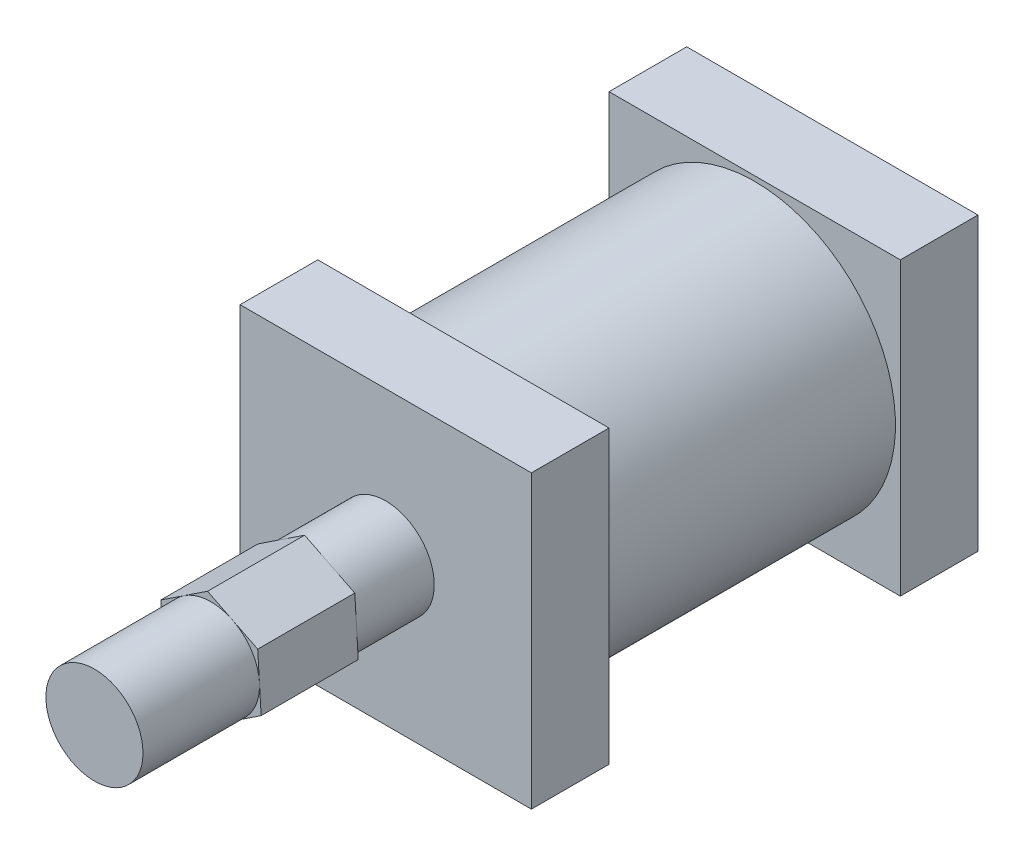
from build123d import *

# Parameters (mm, degrees)
SKETCH1_W           = 38.1
SKETCH1_H           = 38.1
BOSS_EXTRUDE1_DEPTH = 10.16
SKETCH2_R           = 18.415
BOSS_EXTRUDE2_DEPTH = 38.1
SKETCH3_W           = 38.1
SKETCH3_H           = 38.1
BOSS_EXTRUDE3_DEPTH = 10.16
SKETCH4_R           = 6.35
BOSS_EXTRUDE4_DEPTH = 10.16
BOSS_EXTRUDE5_DEPTH = 12.7
SKETCH6_R           = 6.35
BOSS_EXTRUDE6_DEPTH = 15.24


with BuildPart() as part:
    # Sketch1 → Boss-Extrude1 (new body)
    with BuildSketch(Plane.XY):
        with Locations((19.05, 19.05)):
            Rectangle(SKETCH1_W, SKETCH1_H)
    extrude(amount=BOSS_EXTRUDE1_DEPTH)

    # Sketch2 → Boss-Extrude2 (add)
    with BuildSketch(Plane.XY.offset(10.16)):
        with Locations(Location((19.05, 19.05, 0), (0, 0, 180))):
            Circle(SKETCH2_R)
    extrude(amount=BOSS_EXTRUDE2_DEPTH)

    # Sketch3 → Boss-Extrude3 (add)
    with BuildSketch(Plane.XY.offset(48.26)):
        with Locations((19.05, 19.05)):
            Rectangle(SKETCH3_W, SKETCH3_H)
    extrude(amount=BOSS_EXTRUDE3_DEPTH)

    # Sketch4 → Boss-Extrude4 (add)
    with BuildSketch(Plane.XY.offset(58.42)):
        with Locations(Location((19.05, 19.05, 0), (0, 0, 180))):
            Circle(SKETCH4_R)
    extrude(amount=BOSS_EXTRUDE4_DEPTH)

    # Sketch5 → Boss-Extrude5 (add)
    with BuildSketch(Plane.XY.offset(68.58)):
        Polygon((25.164098612, 23.097361053), (18.601931816, 26.368645246), (12.487833204, 22.321284193), (12.935901388, 15.002638947), (19.498068184, 11.731354754), (25.612166796, 15.778715807), align=None)
    extrude(amount=BOSS_EXTRUDE5_DEPTH)

    # Sketch6 → Boss-Extrude6 (add)
    with BuildSketch(Plane.XY.offset(81.28)):
        with Locations(Location((19.05, 19.05, 0), (0, 0, 180))):
            Circle(SKETCH6_R)
    extrude(amount=BOSS_EXTRUDE6_DEPTH)


solid = part.part
